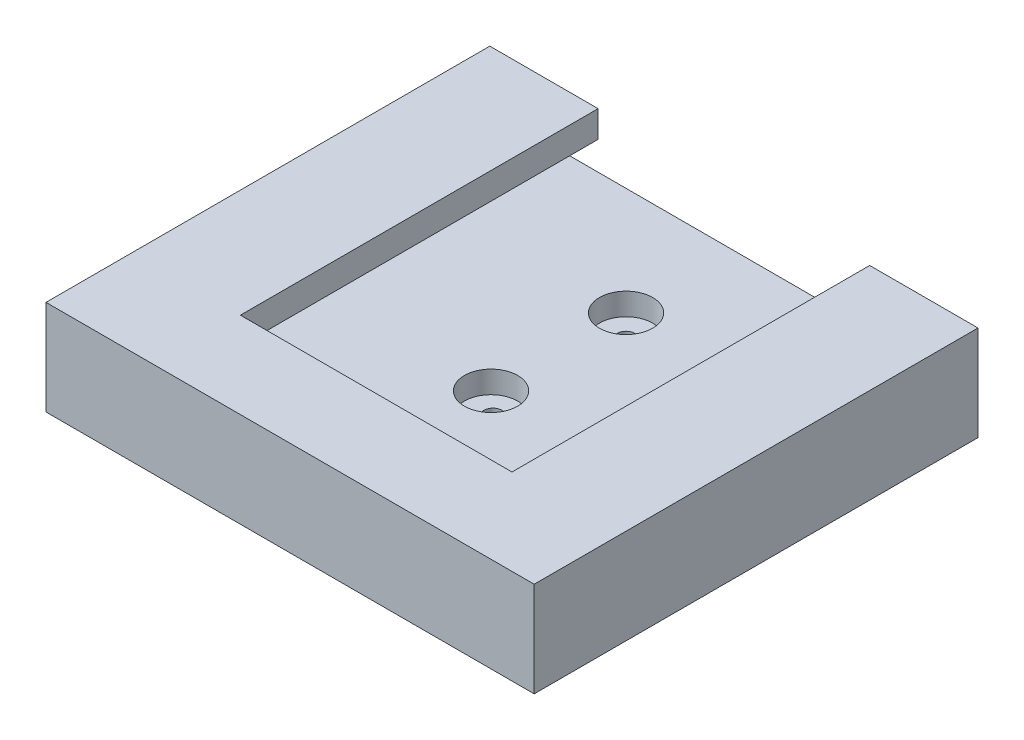
from build123d import *

# Parameters (mm, degrees)
SKETCH1_W           = 55
SKETCH1_H           = 50
BOSS_EXTRUDE1_DEPTH = 10.7
SKETCH2_W           = 30.6
SKETCH2_H           = 40.3
CUT_EXTRUDE2_DEPTH  = 3
SKETCH4_W           = 40.6
SKETCH4_H           = 40.3
CUT_EXTRUDE3_DEPTH  = 3.2
SKETCH13_R          = 3
CUT_EXTRUDE4_DEPTH  = 2.5
SKETCH14_R          = 1
CUT_EXTRUDE5_DEPTH  = 2


with BuildPart() as part:
    # Sketch1 → Boss-Extrude1 (new body)
    with BuildSketch(Plane(origin=(0, 0, 0), x_dir=(1, 0, 0), z_dir=(0, 1, 0))):
        Rectangle(SKETCH1_W, SKETCH1_H)
    extrude(amount=BOSS_EXTRUDE1_DEPTH)

    # Sketch2 → Cut-Extrude2 (cut)
    with BuildSketch(Plane(origin=(0, 10.7, 0), x_dir=(1, 0, 0), z_dir=(0, 1, 0))):
        with Locations((0, 4.85)):
            Rectangle(SKETCH2_W, SKETCH2_H)
    extrude(amount=-CUT_EXTRUDE2_DEPTH, mode=Mode.SUBTRACT)

    # Sketch4 → Cut-Extrude3 (cut)
    with BuildSketch(Plane(origin=(0, 7.7, 0), x_dir=(1, 0, 0), z_dir=(0, 1, 0))):
        with Locations((0, 4.85)):
            Rectangle(SKETCH4_W, SKETCH4_H)
    extrude(amount=-CUT_EXTRUDE3_DEPTH, mode=Mode.SUBTRACT)

    # Sketch13 → Cut-Extrude4 (cut)
    with BuildSketch(Plane(origin=(0, 4.5, 0), x_dir=(1, 0, 0), z_dir=(0, 1, 0))):
        with Locations(Location((0, 12.850318005, 0), (0, 0, 270))):
            Circle(SKETCH13_R)
        with Locations(Location((0, -2.359937211, 0), (0, 0, 270))):
            Circle(SKETCH13_R)
    extrude(amount=-CUT_EXTRUDE4_DEPTH, mode=Mode.SUBTRACT)

    # Sketch14 → Cut-Extrude5 (cut)
    with BuildSketch(Plane(origin=(0, 2, 0), x_dir=(1, 0, 0), z_dir=(0, 1, 0))):
        with Locations(Location((0, 12.850318005, 0), (0, 0, 270))):
            Circle(SKETCH14_R)
        with Locations(Location((0, -2.149681995, 0), (0, 0, 270))):
            Circle(SKETCH14_R)
    extrude(amount=-CUT_EXTRUDE5_DEPTH, mode=Mode.SUBTRACT)


solid = part.part
